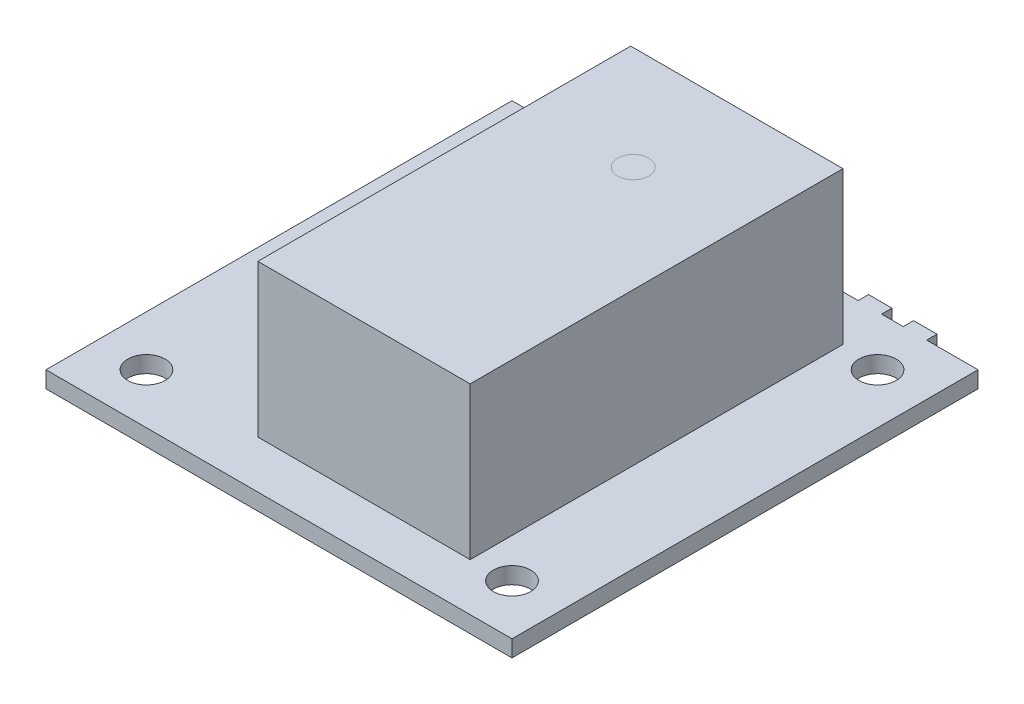
from build123d import *

# Parameters (mm, degrees)
SKETCH1_W           = 45
SKETCH1_H           = 45
SKETCH1_R           = 1.8
BOSS_EXTRUDE1_DEPTH = 0.8
SKETCH2_W           = 2.26484959
SKETCH2_H           = 1
SKETCH2_W_2         = 2.264849589
BOSS_EXTRUDE2_DEPTH = 1.6
SKETCH3_W           = 20.5
SKETCH3_H           = 36
SPARK_CORE_DEPTH    = 14.7


with BuildPart() as part:
    # Sketch1 → Boss-Extrude1 (new, symmetric)
    with BuildSketch(Plane(origin=(0, 0, 0), x_dir=(1, 0, 0), z_dir=(0, 1, 0))):
        Rectangle(SKETCH1_W, SKETCH1_H)
        with Locations(Location((-17.65, 17.65, 0), (0, 0, 270))):
            Circle(SKETCH1_R, mode=Mode.SUBTRACT)
        with Locations(Location((17.65, 17.65, 0), (0, 0, 270))):
            Circle(SKETCH1_R, mode=Mode.SUBTRACT)
        with Locations(Location((17.65, -17.65, 0), (0, 0, 270))):
            Circle(SKETCH1_R, mode=Mode.SUBTRACT)
        with Locations(Location((-17.65, -17.65, 0), (0, 0, 270))):
            Circle(SKETCH1_R, mode=Mode.SUBTRACT)
    extrude(amount=BOSS_EXTRUDE1_DEPTH, both=True)

    # Sketch2 → Boss-Extrude2 (add)
    with BuildSketch(Plane(origin=(0, 0.8, 0), x_dir=(1, 0, 0), z_dir=(0, 1, 0))):
        with Locations((-16.569776824, 23)):
            Rectangle(SKETCH2_W, SKETCH2_H)
        with Locations((-13.030949341, 23)):
            Rectangle(SKETCH2_W_2, SKETCH2_H)
        with Locations((-8.288920513, 23)):
            Rectangle(SKETCH2_W, SKETCH2_H)
        with Locations((-4.113104082, 23)):
            Rectangle(SKETCH2_W_2, SKETCH2_H)
        with Locations((7.140367316, 23)):
            Rectangle(SKETCH2_W_2, SKETCH2_H)
        with Locations((12.059337518, 23)):
            Rectangle(SKETCH2_W_2, SKETCH2_H)
        with Locations((16.412095322, 23)):
            Rectangle(SKETCH2_W, SKETCH2_H)
    extrude(amount=-BOSS_EXTRUDE2_DEPTH)

    # Sketch3 → Spark Core (add)
    with BuildSketch(Plane(origin=(0, 0.8, 0), x_dir=(1, 0, 0), z_dir=(0, 1, 0))):
        with Locations((3.61, 0.1)):
            Rectangle(SKETCH3_W, SKETCH3_H)
    extrude(amount=SPARK_CORE_DEPTH)


solid = part.part
